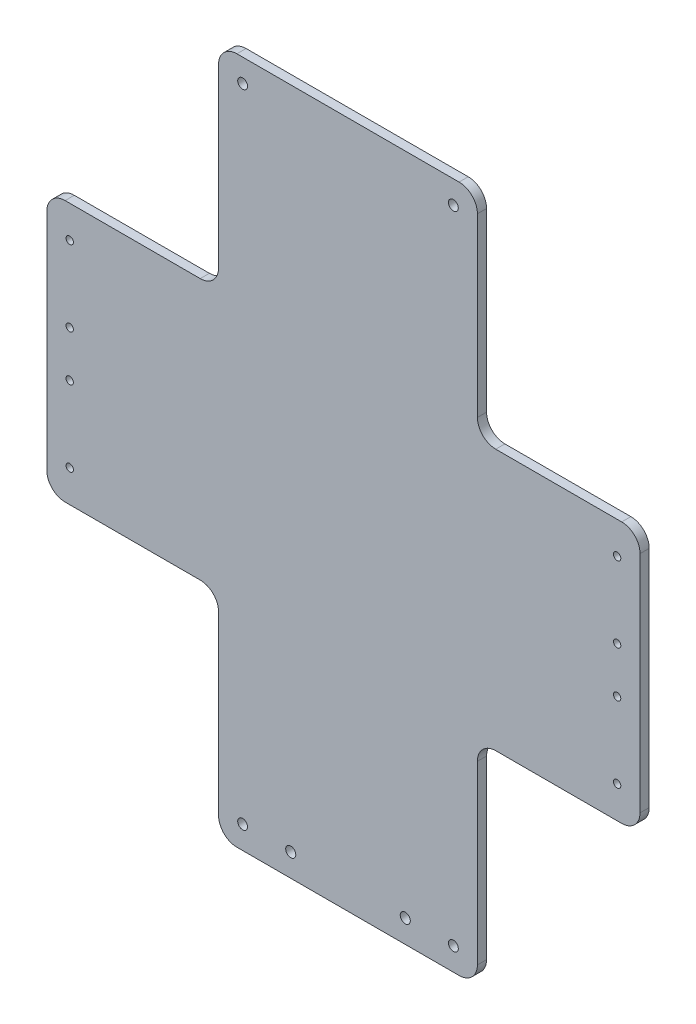
from build123d import *

# Parameters (mm, degrees)
SKETCH_281X300_25_R   = 2.15
SKETCH_281X300_25_R_2 = 2.2
SKETCH_281X300_25_R_3 = 1.6
F_4MM_DEPTH           = 4
FILLET_1_R            = 8


with BuildPart() as part:
    # 底板轮廓_281x300_安装孔外移25 → 凸台拉伸_4mm (new body)
    with BuildSketch(Plane.XY):
        Polygon((-55.5, 150), (-55.5, 57), (-130.5, 57), (-130.5, -57), (-55.5, -57), (-55.5, -150), (57.5, -150), (57.5, -57), (128.5, -57), (128.5, 57), (57.5, 57), (57.5, 150), align=None)
        with Locations((-45, 140)):
            Circle(SKETCH_281X300_25_R, mode=Mode.SUBTRACT)
        with Locations((26, -140)):
            Circle(SKETCH_281X300_25_R_2, mode=Mode.SUBTRACT)
        with Locations((-24, -140)):
            Circle(SKETCH_281X300_25_R_2, mode=Mode.SUBTRACT)
        with Locations((118.5, 10)):
            Circle(SKETCH_281X300_25_R_3, mode=Mode.SUBTRACT)
        with Locations((118.5, -10)):
            Circle(SKETCH_281X300_25_R_3, mode=Mode.SUBTRACT)
        with Locations((-120.5, 10)):
            Circle(SKETCH_281X300_25_R_3, mode=Mode.SUBTRACT)
        with Locations((-120.5, -10)):
            Circle(SKETCH_281X300_25_R_3, mode=Mode.SUBTRACT)
        with Locations((118.5, 43)):
            Circle(SKETCH_281X300_25_R_3, mode=Mode.SUBTRACT)
        with Locations((118.5, -43)):
            Circle(SKETCH_281X300_25_R_3, mode=Mode.SUBTRACT)
        with Locations((-120.5, 43)):
            Circle(SKETCH_281X300_25_R_3, mode=Mode.SUBTRACT)
        with Locations((-120.5, -43)):
            Circle(SKETCH_281X300_25_R_3, mode=Mode.SUBTRACT)
        with Locations((47, 140)):
            Circle(SKETCH_281X300_25_R, mode=Mode.SUBTRACT)
        with Locations((-45, -140)):
            Circle(SKETCH_281X300_25_R, mode=Mode.SUBTRACT)
        with Locations((47, -140)):
            Circle(SKETCH_281X300_25_R, mode=Mode.SUBTRACT)
    extrude(amount=F_4MM_DEPTH)

    # 圆角1
    fillet_1_edges = [part.edges().sort_by_distance(p)[0] for p in [
        (-130.5, 57, 2),
        (-55.5, 57, 2),
        (-55.5, 150, 2),
        (57.5, 150, 2),
        (57.5, 57, 2),
        (128.5, 57, 2),
        (128.5, -57, 2),
        (57.5, -57, 2),
        (57.5, -150, 2),
        (-55.5, -150, 2),
        (-55.5, -57, 2),
        (-130.5, -57, 2),
    ]]
    fillet(fillet_1_edges, radius=FILLET_1_R)


solid = part.part
